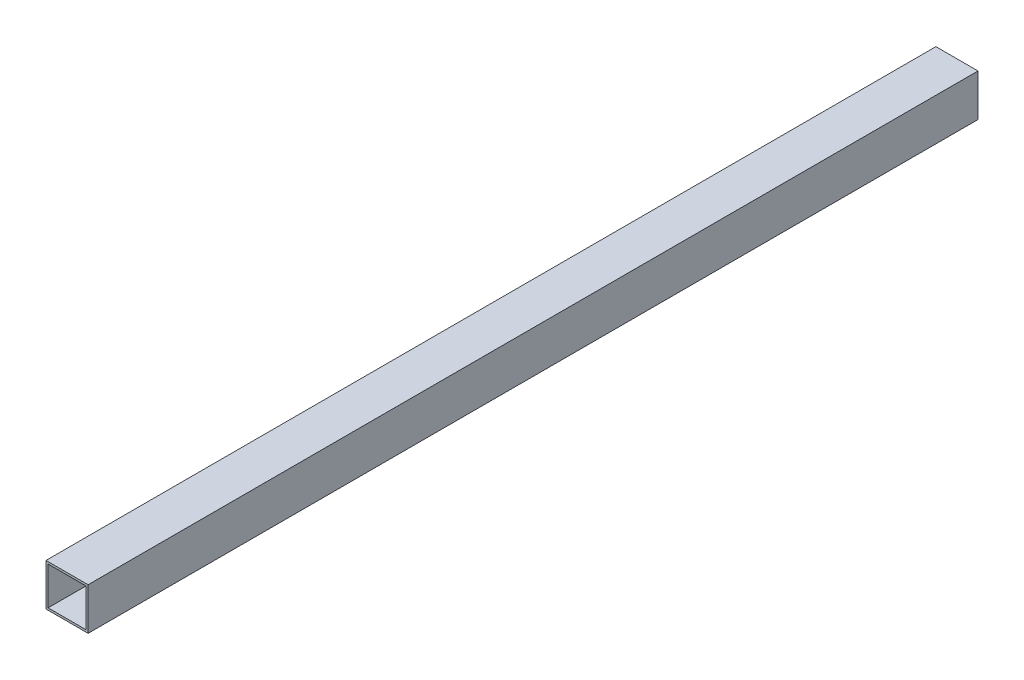
from build123d import *

# Parameters (mm, degrees)
SKETCH1_W           = 20
SKETCH1_H           = 20
SKETCH1_W_2         = 18
SKETCH1_H_2         = 18
BOSS_EXTRUDE1_DEPTH = 422.68


with BuildPart() as part:
    # Sketch1 → Boss-Extrude1 (new body)
    with BuildSketch(Plane.XY):
        with Locations((10, -10)):
            Rectangle(SKETCH1_W, SKETCH1_H)
        with Locations((10, -10)):
            Rectangle(SKETCH1_W_2, SKETCH1_H_2, mode=Mode.SUBTRACT)
    extrude(amount=BOSS_EXTRUDE1_DEPTH)


solid = part.part
